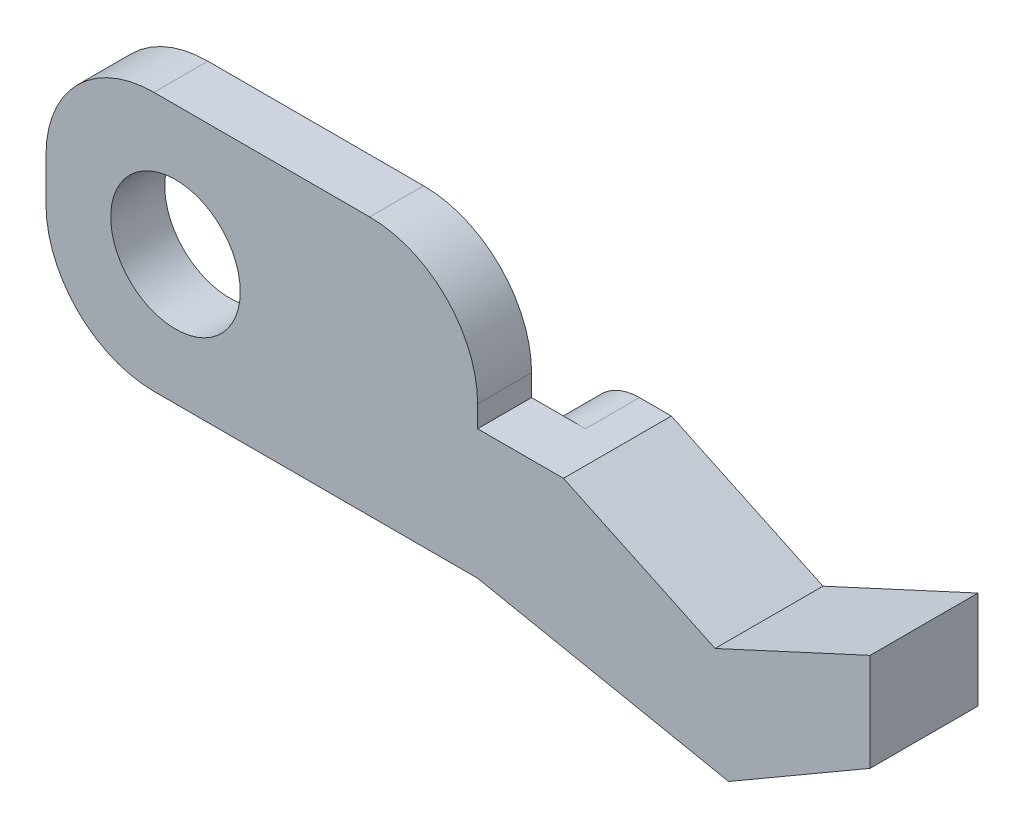
from build123d import *

# Parameters (mm, degrees)
SKETCH1_R           = 6
BOSS_EXTRUDE1_DEPTH = 20
SKETCH3_W           = 4.335084662
SKETCH3_H           = 14.058639044
CUT_EXTRUDE1_DEPTH  = 38
SKETCH4_R           = 3
CUT_EXTRUDE2_DEPTH  = 8
SKETCH5_W           = 6.88313448
SKETCH5_H           = 14.671944549
CUT_EXTRUDE3_DEPTH  = 40
BOSS_EXTRUDE3_DEPTH = 2.5
SKETCH8_W           = 20.918612023
SKETCH8_H           = 4.062773159
CUT_EXTRUDE4_DEPTH  = 12.5
SKETCH9_W           = 20
SKETCH9_H           = 12
BOSS_EXTRUDE4_DEPTH = 2.5
FILLET1_R           = 5
SKETCH10_R          = 3
CUT_EXTRUDE5_DEPTH  = 6.5
FILLET2_R           = 2.5


with BuildPart() as part:
    # Sketch1 → Boss-Extrude1 (new body)
    with BuildSketch(Plane(origin=(0, 0, 0), x_dir=(0, 0, -1), z_dir=(1, 0, 0))):
        Circle(SKETCH1_R)
    extrude(amount=BOSS_EXTRUDE1_DEPTH)

    # Sketch3 → Cut-Extrude1 (cut)
    with BuildSketch(Plane.ZY):
        with Locations((4.667542331, 0.290740447)):
            Rectangle(SKETCH3_W, SKETCH3_H)
    extrude(amount=-CUT_EXTRUDE1_DEPTH, mode=Mode.SUBTRACT)

    # Sketch4 → Cut-Extrude2 (cut)
    with BuildSketch(Plane.XY.offset(2.5)):
        with Locations((5, 0)):
            Circle(SKETCH4_R)
    extrude(amount=-CUT_EXTRUDE2_DEPTH, mode=Mode.SUBTRACT)

    # Sketch5 → Cut-Extrude3 (cut)
    with BuildSketch(Plane(origin=(0, 0, 0), x_dir=(0, 0, -1), z_dir=(1, 0, 0))):
        with Locations((5.94156724, -0.380383747)):
            Rectangle(SKETCH5_W, SKETCH5_H)
    extrude(amount=CUT_EXTRUDE3_DEPTH, mode=Mode.SUBTRACT)

    # Sketch7 → Boss-Extrude3 (add, symmetric)
    with BuildSketch(Plane.XY):
        Polygon((20, 0), (20, -6), (31.63118386, -8.340680909), (38.187356623, -4.535759216), (38.187356623, 0), (31.004497384, -3.314892174), (23.978377494, 0), align=None)
    extrude(amount=BOSS_EXTRUDE3_DEPTH, both=True)

    # Sketch8 → Cut-Extrude4 (cut, symmetric)
    with BuildSketch(Plane(origin=(0, 0, 0), x_dir=(1, 0, 0), z_dir=(0, 1, 0))):
        with Locations((9.540693988, 2.03138658)):
            Rectangle(SKETCH8_W, SKETCH8_H)
    extrude(amount=CUT_EXTRUDE4_DEPTH, both=True, mode=Mode.SUBTRACT)

    # Sketch9 → Boss-Extrude4 (add)
    with BuildSketch(Plane.XY.offset(2.5)):
        with Locations((10, 0)):
            Rectangle(SKETCH9_W, SKETCH9_H)
    extrude(amount=-BOSS_EXTRUDE4_DEPTH)

    # Fillet1
    fillet1_edges = [part.edges().sort_by_distance(p)[0] for p in [
        (0, 6, 1.25),
        (0, -6, 1.25),
        (20, 6, 1.25),
    ]]
    fillet(fillet1_edges, radius=FILLET1_R)

    # Sketch10 → Cut-Extrude5 (cut)
    with BuildSketch(Plane.XY.offset(2.5)):
        with Locations((6, 0)):
            Circle(SKETCH10_R)
    extrude(amount=-CUT_EXTRUDE5_DEPTH, mode=Mode.SUBTRACT)

    # Fillet2
    fillet2_edges = [part.edges().sort_by_distance(p)[0] for p in [
        (20, -6, -1.25),
        (20, 0, -1.25),
    ]]
    fillet(fillet2_edges, radius=FILLET2_R)


solid = part.part
